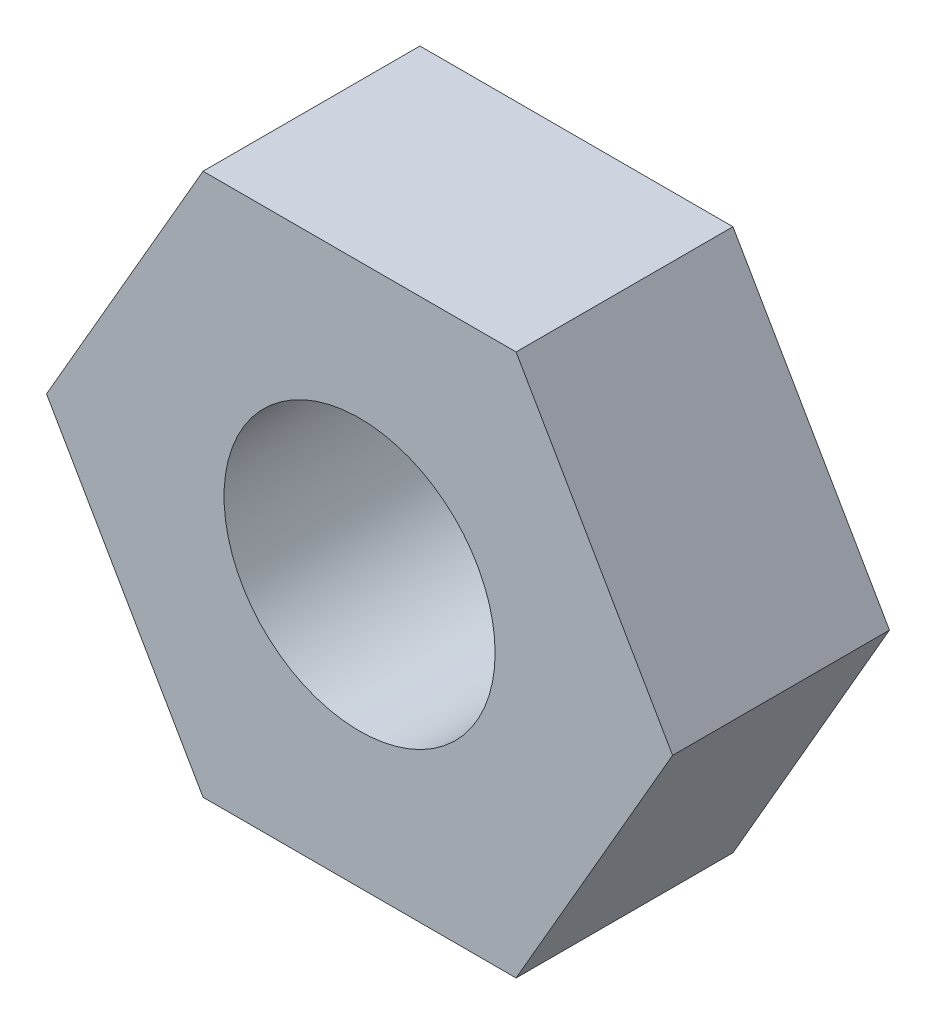
from build123d import *

# Parameters (mm, degrees)
BASE_R     = 1
BODY_DEPTH = 1.6


with BuildPart() as part:
    # Base → Body (new body)
    with BuildSketch(Plane.XY):
        Polygon((1.154700538, 2), (-1.154700538, 2), (-2.309401077, 0), (-1.154700538, -2), (1.154700538, -2), (2.309401077, 0), align=None)
        Circle(BASE_R, mode=Mode.SUBTRACT)
    extrude(amount=BODY_DEPTH)


solid = part.part
